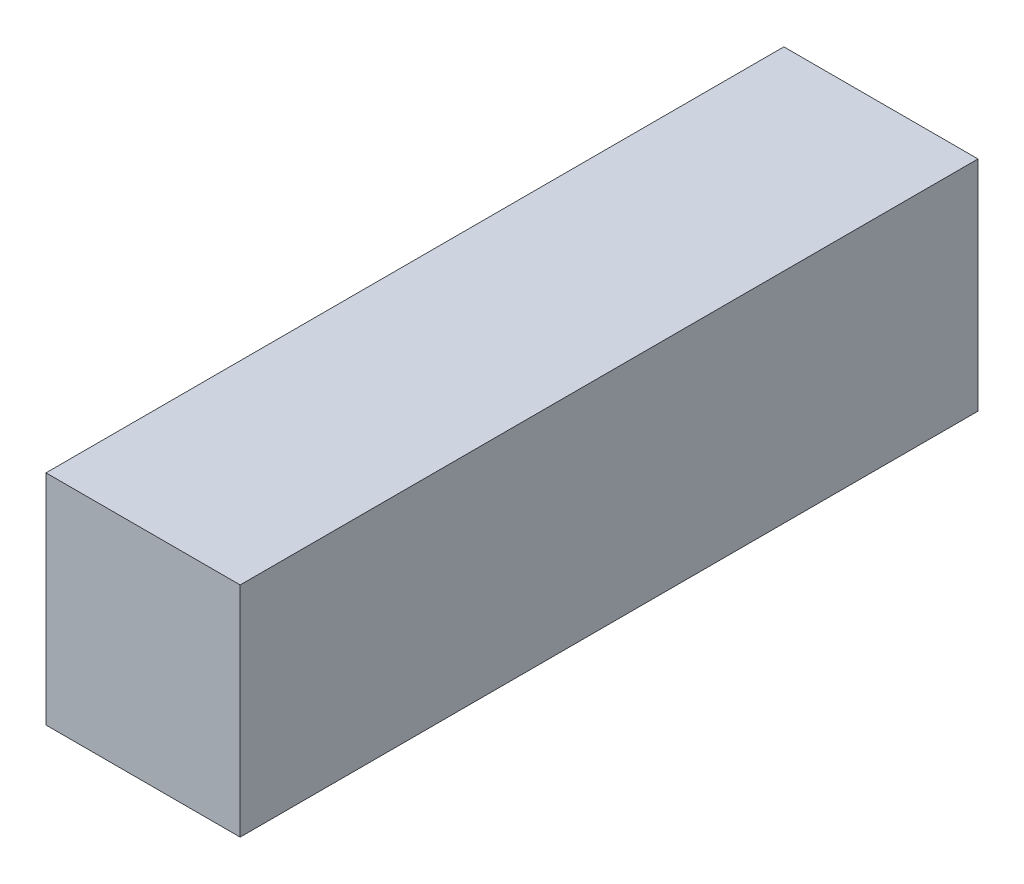
from build123d import *

# Parameters (mm, degrees)
SKETCH1_W           = 48.26
SKETCH1_H           = 14.2875
BOSS_EXTRUDE1_DEPTH = 12.7


with BuildPart() as part:
    # Sketch1 → Boss-Extrude1 (new body)
    with BuildSketch(Plane(origin=(0, 0, 0), x_dir=(0, 0, -1), z_dir=(1, 0, 0))):
        with Locations((24.13, 7.14375)):
            Rectangle(SKETCH1_W, SKETCH1_H)
    extrude(amount=BOSS_EXTRUDE1_DEPTH)


solid = part.part
